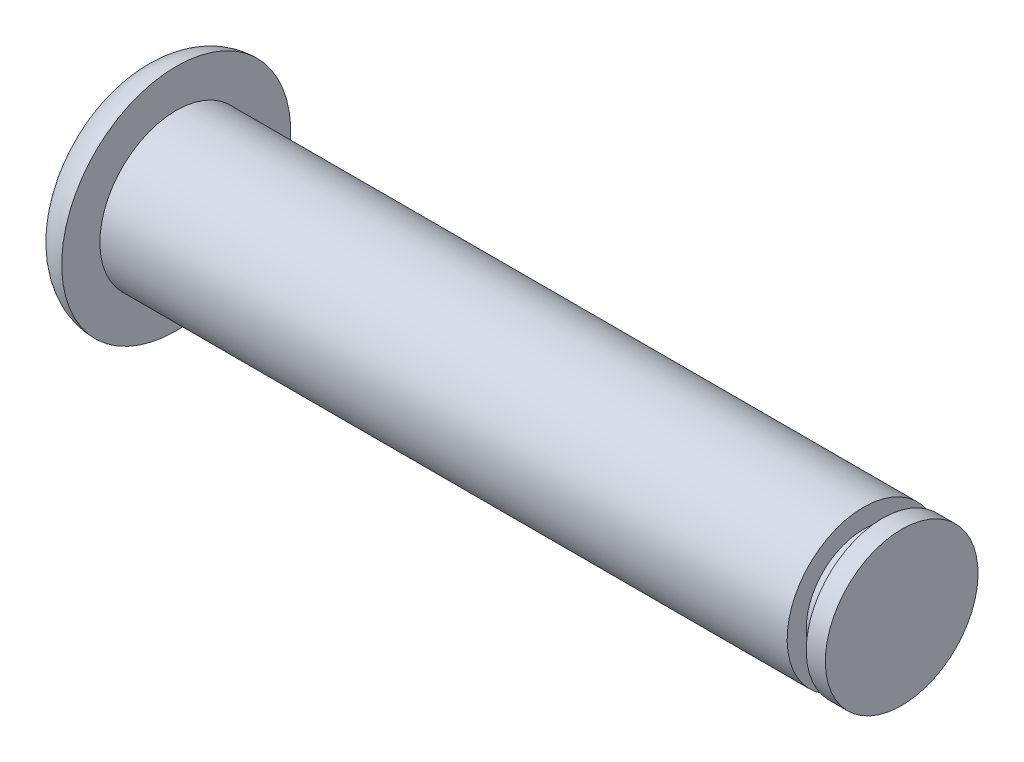
from build123d import *


with BuildPart() as part:
    # Sketch1 → Revolve1 (revolve)
    with BuildSketch(Plane(origin=(0, 0, 0), x_dir=(-1, 0, 0), z_dir=(0, 0, -1))):
        with BuildLine():
            ThreePointArc((20, 2), (19.707106781, 2.707106781), (19, 3))
            Line((19, 3), (19, 2))
            Line((19, 2), (1, 2))
            Line((1, 2), (1, 1.5))
            Line((1, 1.5), (0.5, 1.5))
            Line((0.5, 1.5), (0.5, 2))
            Line((0.5, 2), (0, 2))
            Line((0, 2), (0, 0))
            Line((0, 0), (20, 0))
            Line((20, 0), (20, 2))
        make_face()
    revolve(axis=Axis((0, 0, 0), (-1, 0, 0)))


solid = part.part
